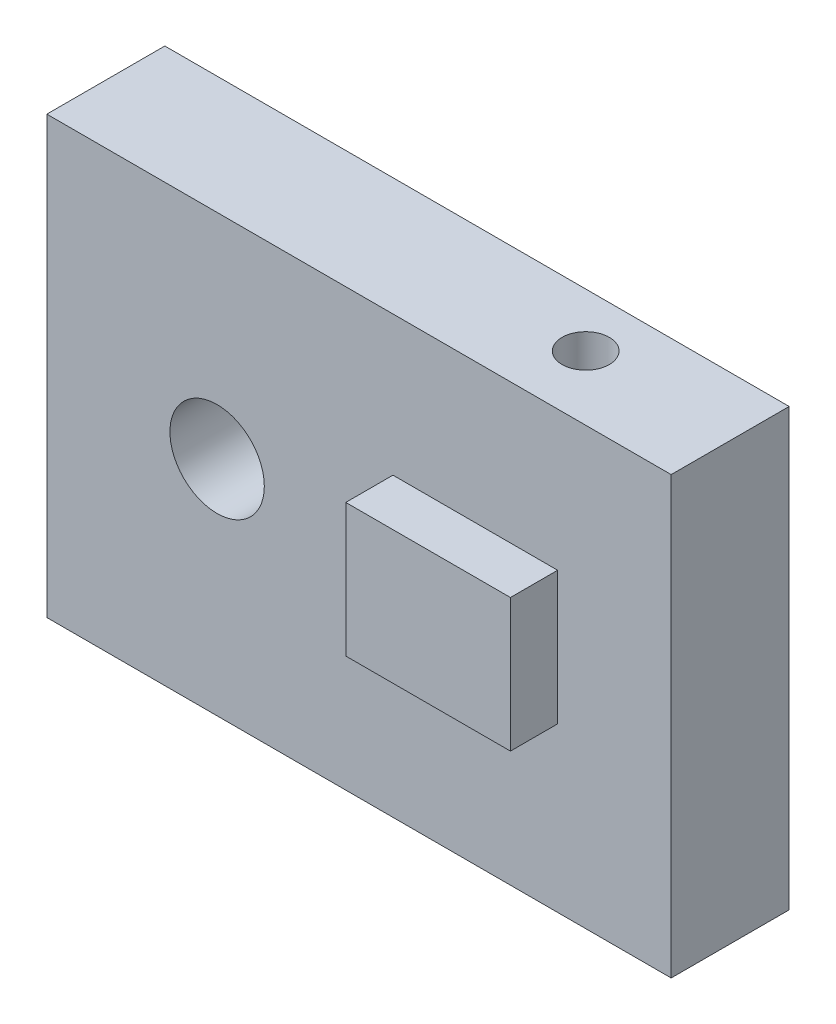
from build123d import *

# Parameters (mm, degrees)
SKETCH1_W              = 132.276038998
SKETCH1_H              = 92.368395504
BOSS_EXTRUDE1_DEPTH    = 25
F_20_0MM_DOWEL_HOLE1_D = 20
F_10_0MM_DOWEL_HOLE1_D = 10
SKETCH8_W              = 34.889280452
SKETCH8_H              = 28.187384772
BOSS_EXTRUDE2_DEPTH    = 10


with BuildPart() as part:
    # Sketch1 → Boss-Extrude1 (new body)
    with BuildSketch(Plane.XY):
        Rectangle(SKETCH1_W, SKETCH1_H)
    extrude(amount=BOSS_EXTRUDE1_DEPTH)

    # Ø20.0mm Dowel Hole1 (through all)
    with Locations(Plane.XY.offset(25)):
        with Locations((-30.059973271, 0.936294249)):
            Hole(F_20_0MM_DOWEL_HOLE1_D / 2)

    # Ø10.0mm Dowel Hole1 (through all)
    with Locations(Plane(origin=(0, 46.184197752, 0), x_dir=(1, 0, 0), z_dir=(0, 1, 0))):
        with Locations((34.396494005, -11.366591172)):
            Hole(F_10_0MM_DOWEL_HOLE1_D / 2)

    # Sketch8 → Boss-Extrude2 (add)
    with BuildSketch(Plane.XY.offset(25)):
        with Locations((24.639322353, 2.51321088)):
            Rectangle(SKETCH8_W, SKETCH8_H)
    extrude(amount=BOSS_EXTRUDE2_DEPTH)


solid = part.part
